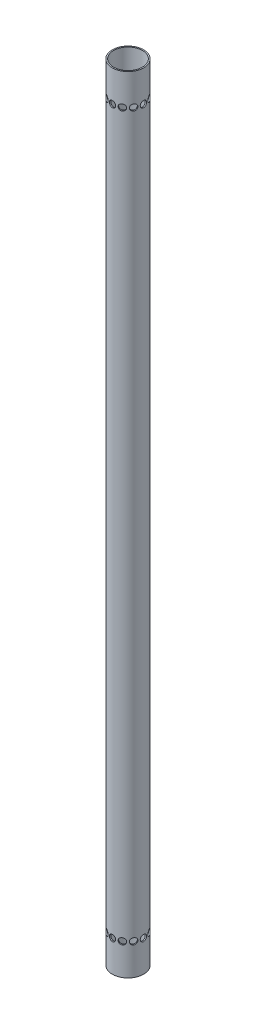
from build123d import *

# Parameters (mm, degrees)
SKETCH1_R           = 25
SKETCH1_R_2         = 23
BOSS_EXTRUDE1_DEPTH = 1250
SKETCH6_R           = 5
CUT_EXTRUDE1_DEPTH  = 76
CIRPATTERN2_COUNT   = 6
CIRPATTERN2_ANGLE   = 150


with BuildPart() as part:
    # Sketch1 → Boss-Extrude1 (new body)
    with BuildSketch(Plane(origin=(0, 0, 0), x_dir=(1, 0, 0), z_dir=(0, 1, 0))):
        with Locations(Location((0, 0, 0), (0, 0, 270))):
            Circle(SKETCH1_R)
        with Locations(Location((0, 0, 0), (0, 0, 270))):
            Circle(SKETCH1_R_2, mode=Mode.SUBTRACT)
    extrude(amount=BOSS_EXTRUDE1_DEPTH)

    # Sketch6 → Cut-Extrude1 (cut)
    with BuildSketch(Plane.ZY.offset(25)):
        with Locations((0, 50)):
            Circle(SKETCH6_R)
        with Locations((0, 1200)):
            Circle(SKETCH6_R)
    cut_extrude1 = extrude(amount=-CUT_EXTRUDE1_DEPTH, mode=Mode.SUBTRACT)

    # CirPattern2: Cut-Extrude1 ×6 about axis
    cirpattern2_axis = Axis((0, 1250, 0), (0, -1, 0))
    for i in range(1, CIRPATTERN2_COUNT):
        add(cut_extrude1.rotate(cirpattern2_axis, i * CIRPATTERN2_ANGLE / (CIRPATTERN2_COUNT - 1)), mode=Mode.SUBTRACT)


solid = part.part
